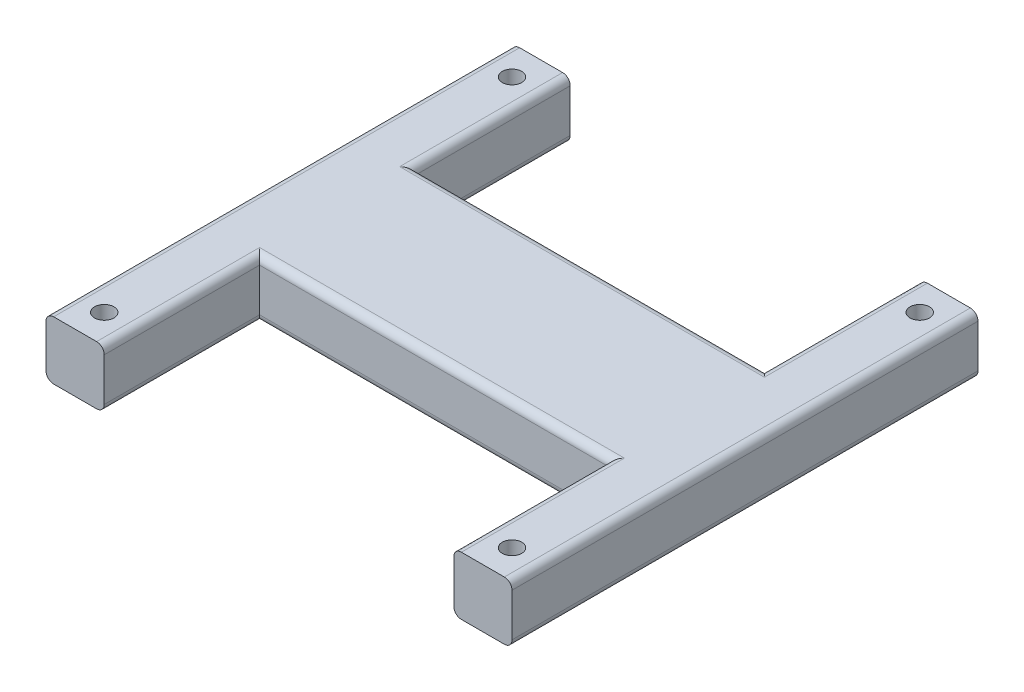
from build123d import *

# Parameters (mm, degrees)
SKETCH1_W                                  = 609.6
SKETCH1_H                                  = 609.6
BOSS_EXTRUDE1_DEPTH                        = 76.2
SKETCH2_W                                  = 457.2
SKETCH2_H                                  = 203.2
CUT_EXTRUDE1_DEPTH                         = 76.2
SKETCH3_R                                  = 12.7
CUT_EXTRUDE2_DEPTH                         = 38.1
MIRROR1_AT_THE_SECOND_PLANE_COPY_1_SKETC_R = 12.7
MIRROR1_AT_THE_SECOND_PLANE_COPY_1_DEPTH   = 38.1
SKETCH6_R                                  = 74.93
CUT_EXTRUDE3_DEPTH                         = 6.35
FILLET1_R                                  = 2.54
SKETCH7_R                                  = 4.4958
CUT_EXTRUDE4_DEPTH                         = 20
CIRPATTERN1_COUNT                          = 4
FILLET2_R                                  = 10


with BuildPart() as part:
    # Sketch1 → Boss-Extrude1 (new body)
    with BuildSketch(Plane(origin=(0, 0, 0), x_dir=(1, 0, 0), z_dir=(0, 1, 0))):
        Rectangle(SKETCH1_W, SKETCH1_H)
    extrude(amount=BOSS_EXTRUDE1_DEPTH)

    # Sketch2 → Cut-Extrude1 (cut)
    with BuildSketch(Plane(origin=(0, 76.2, 0), x_dir=(1, 0, 0), z_dir=(0, 1, 0))):
        with Locations((0, -203.2)):
            Rectangle(SKETCH2_W, SKETCH2_H)
        with Locations((0, 203.2)):
            Rectangle(SKETCH2_W, SKETCH2_H)
    extrude(amount=-CUT_EXTRUDE1_DEPTH, mode=Mode.SUBTRACT)

    # Sketch3 → Cut-Extrude2 (cut)
    with BuildSketch(Plane(origin=(0, 76.2, 0), x_dir=(1, 0, 0), z_dir=(0, 1, 0))):
        with Locations(Location((-266.7, 266.7, 0), (0, 0, 270))):
            Circle(SKETCH3_R)
    cut_extrude2 = extrude(amount=-CUT_EXTRUDE2_DEPTH, mode=Mode.SUBTRACT)

    # Mirror1: Cut-Extrude2 across plane
    add(cut_extrude2.mirror(Plane(origin=(0, 0, 0), x_dir=(0, 0, 1), z_dir=(1, 0, 0))), mode=Mode.SUBTRACT)

    # Mirror1 at the second plane: Cut-Extrude2 across plane
    add(cut_extrude2.mirror(Plane.XY), mode=Mode.SUBTRACT)

    # Mirror1 at the second plane copy 1 sketc → Mirror1 at the second plane copy 1 (cut)
    with BuildSketch(Plane(origin=(0, 76.2, 0), x_dir=(-1, 0, 0), z_dir=(0, 1, 0))):
        with Locations(Location((-266.7, 266.7, 0), (0, 0, 270))):
            Circle(MIRROR1_AT_THE_SECOND_PLANE_COPY_1_SKETC_R)
    extrude(amount=-MIRROR1_AT_THE_SECOND_PLANE_COPY_1_DEPTH, mode=Mode.SUBTRACT)

    # Sketch6 → Cut-Extrude3 (cut)
    with BuildSketch(Plane.XZ):
        with Locations(Location((0, 0, 0), (0, 0, 270))):
            Circle(SKETCH6_R)
    extrude(amount=-CUT_EXTRUDE3_DEPTH, mode=Mode.SUBTRACT)

    # Fillet1
    fillet1_edges = [part.edges().sort_by_distance(p)[0] for p in [
        (0, 0, 74.93),
    ]]
    fillet(fillet1_edges, radius=FILLET1_R)

    # Sketch7 → Cut-Extrude4 (cut)
    with BuildSketch(Plane.XZ):
        with Locations(Location((0, 66, 0), (0, 0, 270))):
            Circle(SKETCH7_R)
    cut_extrude4 = extrude(amount=-CUT_EXTRUDE4_DEPTH, mode=Mode.SUBTRACT)

    # CirPattern1: Cut-Extrude4 ×4 about axis
    cirpattern1_axis = Axis((0, 0, 0), (0, 1, 0))
    for i in range(1, CIRPATTERN1_COUNT):
        add(cut_extrude4.rotate(cirpattern1_axis, i * 360 / CIRPATTERN1_COUNT), mode=Mode.SUBTRACT)

    # Fillet2
    fillet2_edges = [part.edges().sort_by_distance(p)[0] for p in [
        (-304.8, 76.2, 0),
        (-228.6, 0, 203.2),
        (0, 0, 101.6),
        (228.6, 0, 203.2),
        (-228.6, 76.2, 203.2),
        (228.6, 76.2, 203.2),
        (0, 76.2, 101.6),
        (-228.6, 0, -203.2),
        (228.6, 0, -203.2),
        (0, 0, -101.6),
        (-228.6, 76.2, -203.2),
        (0, 76.2, -101.6),
        (228.6, 76.2, -203.2),
        (304.8, 76.2, 0),
        (-304.8, 0, 0),
        (304.8, 0, 0),
    ]]
    fillet(fillet2_edges, radius=FILLET2_R)


solid = part.part
